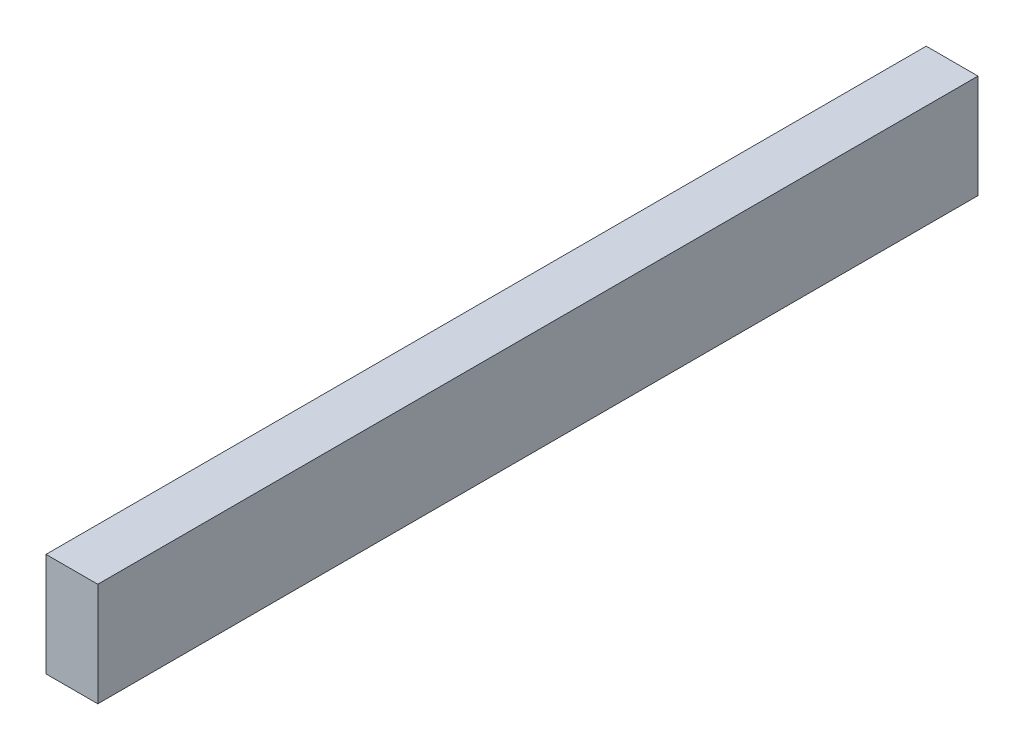
from build123d import *

# Parameters (mm, degrees)
SKETCH1_W           = 50.8
SKETCH1_H           = 101.6
BOSS_EXTRUDE1_DEPTH = 863.6


with BuildPart() as part:
    # Sketch1 → Boss-Extrude1 (new body)
    with BuildSketch(Plane.XY):
        Rectangle(SKETCH1_W, SKETCH1_H)
    extrude(amount=BOSS_EXTRUDE1_DEPTH)


solid = part.part
